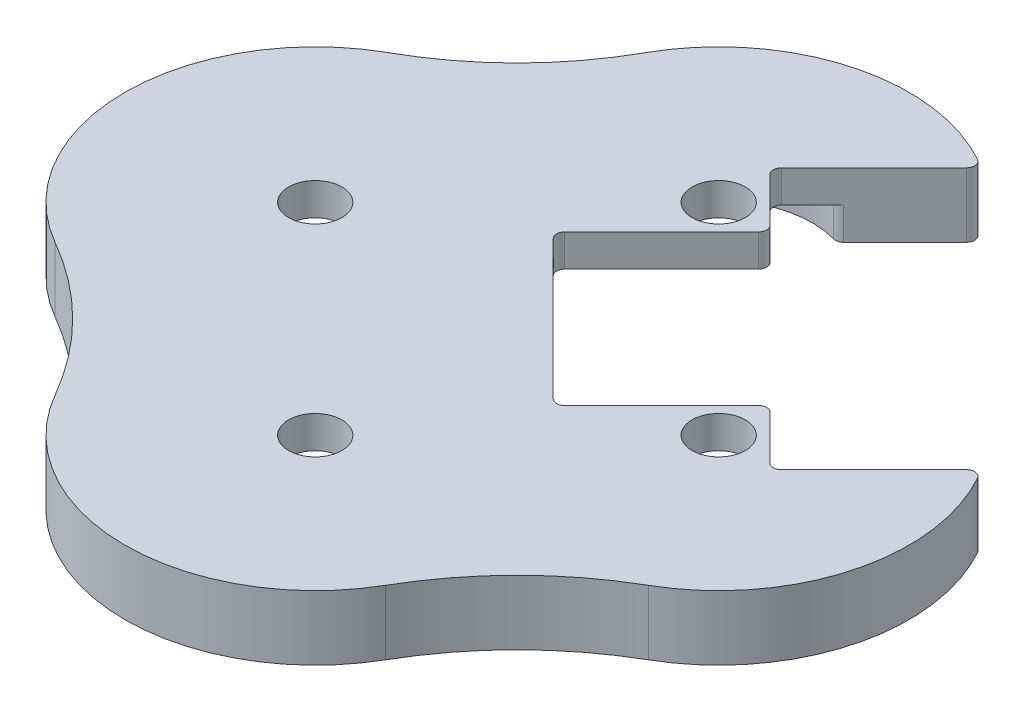
from build123d import *

# Parameters (mm, degrees)
SKETCH_1_R          = 1.65
EXTRUDE_1_DEPTH     = 4
SKETCH_1_4_R        = 1.65
CUT_EXTRUDE_4_DEPTH = 2
CUT_EXTRUDE_2_DEPTH = 35.597398746
FILLET_1_R          = 0.5


with BuildPart() as part:
    # 草图1 → 凸台-拉伸1 (new body)
    with BuildSketch(Plane(origin=(0, 0, 0), x_dir=(1, 0, 0), z_dir=(0, 1, 0))):
        with BuildLine():
            ThreePointArc((10.308655527, 18.24209206), (0, 24.3), (-10.308655527, 18.24209206))
            ThreePointArc((-10.308655527, 18.24209206), (-13.722071454, 13.722071454), (-18.24209206, 10.308655527))
            ThreePointArc((-18.24209206, 10.308655527), (-24.299735034, 0.079076788), (-18.37973853, -10.230770979))
            ThreePointArc((-18.37973853, -10.230770979), (-13.764731337, -13.764731337), (-10.230770979, -18.37973853))
            ThreePointArc((-10.230770979, -18.37973853), (0, -24.3), (10.230770979, -18.37973853))
            ThreePointArc((10.230770979, -18.37973853), (13.764731337, -13.764731337), (18.37973853, -10.230770979))
            ThreePointArc((18.37973853, -10.230770979), (24.299735034, 0.079076788), (18.24209206, 10.308655527))
            ThreePointArc((18.24209206, 10.308655527), (13.722071454, 13.722071454), (10.308655527, 18.24209206))
        make_face()
        with Locations((-12.5, 0)):
            Circle(SKETCH_1_R, mode=Mode.SUBTRACT)
        with Locations((0, -12.5)):
            Circle(SKETCH_1_R, mode=Mode.SUBTRACT)
        with Locations((12.5, 0)):
            Circle(SKETCH_1_R, mode=Mode.SUBTRACT)
        with Locations((0, 12.5)):
            Circle(SKETCH_1_R, mode=Mode.SUBTRACT)
    extrude(amount=EXTRUDE_1_DEPTH)

    # 草图1<4> → 切除-拉伸4 (cut)
    with BuildSketch(Plane(origin=(0, 0, 0), x_dir=(1, 0, 0), z_dir=(0, 1, 0))):
        with BuildLine():
            ThreePointArc((15.322384233, 5.066966276), (9.479430767, 9.479430767), (5.066966276, 15.322384233))
            ThreePointArc((5.066966276, 15.322384233), (0, 18.3), (-5.066966276, 15.322384233))
            ThreePointArc((-5.066966276, 15.322384233), (-9.479430767, 9.479430767), (-15.322384233, 5.066966276))
            ThreePointArc((-15.322384233, 5.066966276), (-18.299869762, 0.038868252), (-15.390040972, -5.02868404))
            ThreePointArc((-15.390040972, -5.02868404), (-9.52209065, -9.52209065), (-5.02868404, -15.390040972))
            ThreePointArc((-5.02868404, -15.390040972), (0, -18.3), (5.02868404, -15.390040972))
            ThreePointArc((5.02868404, -15.390040972), (9.52209065, -9.52209065), (15.390040972, -5.02868404))
            ThreePointArc((15.390040972, -5.02868404), (18.299869762, 0.038868252), (15.322384233, 5.066966276))
        make_face()
        with Locations((-12.5, 0)):
            Circle(SKETCH_1_4_R, mode=Mode.SUBTRACT)
        with Locations((0, -12.5)):
            Circle(SKETCH_1_4_R, mode=Mode.SUBTRACT)
        with Locations((12.5, 0)):
            Circle(SKETCH_1_4_R, mode=Mode.SUBTRACT)
        with Locations((0, 12.5)):
            Circle(SKETCH_1_4_R, mode=Mode.SUBTRACT)
    extrude(amount=CUT_EXTRUDE_4_DEPTH, mode=Mode.SUBTRACT)

    # 草图3 → 切除-拉伸2 (cut, through all)
    with BuildSketch(Plane(origin=(0, 4, 0), x_dir=(1, 0, 0), z_dir=(0, 1, 0))):
        with BuildLine():
            Line((6.285747384, 22.486459824), (-0.25936461, 15.94134783))
            Line((-0.25936461, 15.94134783), (3.181980515, 12.499997674))
            Line((3.181980515, 12.499997674), (-3.535538817, 5.782488163))
            Line((-3.535538817, 5.782488163), (1.123471267, 1.123471267))
            Line((1.123471267, 1.123471267), (5.782488163, -3.535538817))
            Line((5.782488163, -3.535538817), (12.499997674, 3.181980515))
            Line((12.499997674, 3.181980515), (15.94134783, -0.25936461))
            Line((15.94134783, -0.25936461), (22.486459824, 6.285747384))
            ThreePointArc((22.486459824, 6.285747384), (20.617437008, 8.564298945), (18.24209206, 10.308655527))
            ThreePointArc((18.24209206, 10.308655527), (13.722071454, 13.722071454), (10.308655527, 18.24209206))
            ThreePointArc((10.308655527, 18.24209206), (8.564298945, 20.617437008), (6.285747384, 22.486459824))
        make_face()
    extrude(amount=-CUT_EXTRUDE_2_DEPTH, mode=Mode.SUBTRACT)

    # 圆角1
    fillet_1_edges = [part.edges().sort_by_distance(p)[0] for p in [
        (18.010435708, 1, -1.809723268),
        (1.809723268, 1, -18.010435708),
        (6.285747384, 2, -22.486459824),
        (22.486459824, 2, -6.285747384),
        (-0.25936461, 3, -15.94134783),
        (3.181980515, 3, -12.499997674),
        (-3.535538817, 3, -5.782488163),
        (5.782488163, 3, 3.535538817),
        (15.94134783, 3, 0.25936461),
        (12.499997674, 3, -3.181980515),
    ]]
    fillet(fillet_1_edges, radius=FILLET_1_R)


solid = part.part
